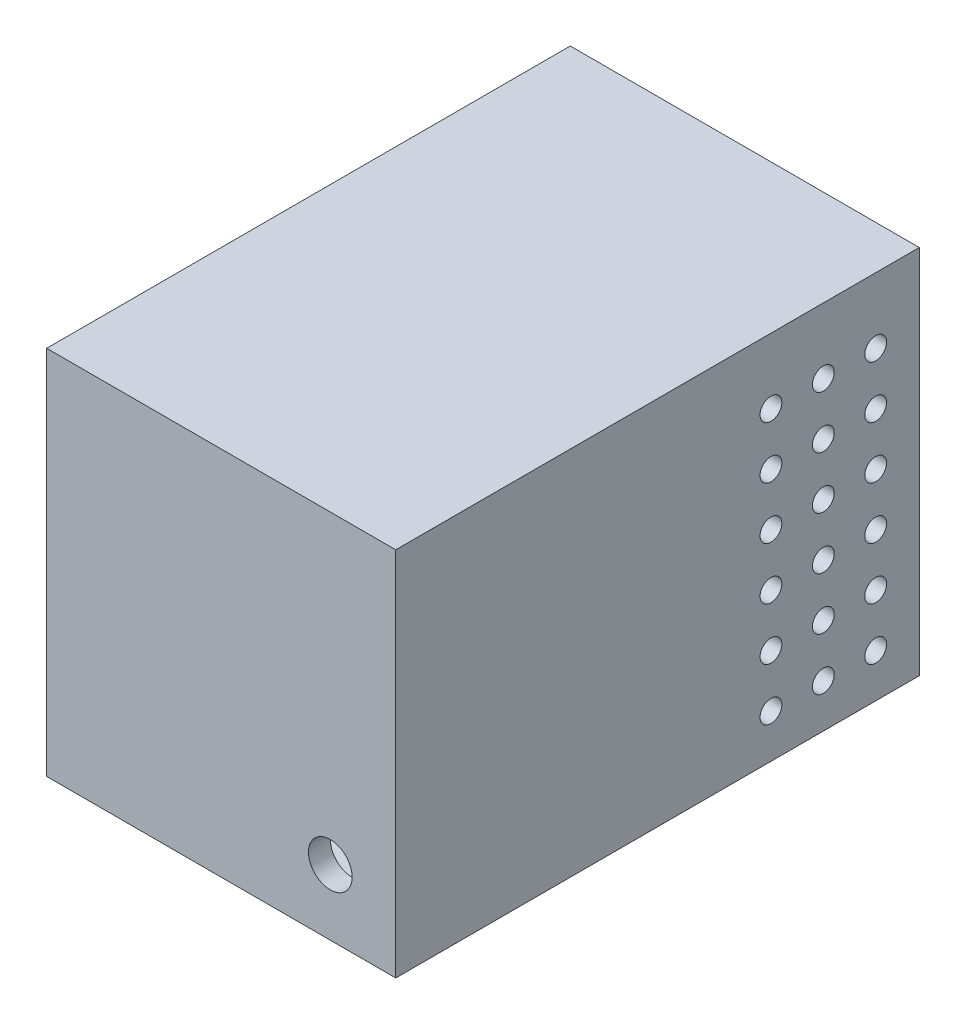
from build123d import *

# Parameters (mm, degrees)
SKETCH1_W               = 101.6
SKETCH1_H               = 152.4
BOSS_EXTRUDE1_DEPTH     = 101.6
SKETCH3_W               = 88.9
SKETCH3_H               = 139.7
CUT_EXTRUDE1_DEPTH      = 95.25
SKETCH4_W               = 88.9
SKETCH4_H               = 6.35
BOSS_EXTRUDE2_DEPTH     = 95.25
SKETCH6_R               = 3.175
CUT_EXTRUDE2_DEPTH      = 207.448256229
SKETCH7_R               = 3.175
CUT_EXTRUDE3_DEPTH      = 207.448256229
CUT_EXTRUDE5_DEPTH      = 210.453765781
CUT_EXTRUDE5_DEPTH_BACK = 6.35
SKETCH8_R               = 3.175
SKETCH9_W               = 101.6
SKETCH9_H               = 152.4
BOSS_EXTRUDE3_DEPTH     = 6.35
SKETCH10_R              = 6.35
CUT_EXTRUDE6_DEPTH      = 6.35


with BuildPart() as part:
    # Sketch1 → Boss-Extrude1 (new body)
    with BuildSketch(Plane(origin=(0, 0, 0), x_dir=(1, 0, 0), z_dir=(0, 1, 0))):
        with Locations((50.8, 76.2)):
            Rectangle(SKETCH1_W, SKETCH1_H)
    extrude(amount=BOSS_EXTRUDE1_DEPTH)

    # Sketch3 → Cut-Extrude1 (cut)
    with BuildSketch(Plane(origin=(0, 101.6, 0), x_dir=(1, 0, 0), z_dir=(0, 1, 0))):
        with Locations((50.8, 76.2)):
            Rectangle(SKETCH3_W, SKETCH3_H)
    extrude(amount=-CUT_EXTRUDE1_DEPTH, mode=Mode.SUBTRACT)

    # Sketch4 → Boss-Extrude2 (add)
    with BuildSketch(Plane(origin=(0, 6.35, 0), x_dir=(1, 0, 0), z_dir=(0, 1, 0))):
        with Locations((50.8, 98.425)):
            Rectangle(SKETCH4_W, SKETCH4_H)
    extrude(amount=BOSS_EXTRUDE2_DEPTH)

    # Sketch6 → Cut-Extrude2 (cut, through all)
    with BuildSketch(Plane.ZY.offset(-95.25)):
        with Locations((-139.7, 12.7)):
            Circle(SKETCH6_R)
        with Locations((-124.46, 12.7)):
            Circle(SKETCH6_R)
        with Locations((-109.22, 12.7)):
            Circle(SKETCH6_R)
        with Locations((-124.46, 27.94)):
            Circle(SKETCH6_R)
        with Locations((-109.22, 27.94)):
            Circle(SKETCH6_R)
        with Locations((-124.46, 43.18)):
            Circle(SKETCH6_R)
        with Locations((-109.22, 43.18)):
            Circle(SKETCH6_R)
        with Locations((-124.46, 58.42)):
            Circle(SKETCH6_R)
        with Locations((-109.22, 58.42)):
            Circle(SKETCH6_R)
        with Locations((-124.46, 73.66)):
            Circle(SKETCH6_R)
        with Locations((-109.22, 73.66)):
            Circle(SKETCH6_R)
        with Locations((-124.46, 88.9)):
            Circle(SKETCH6_R)
        with Locations((-109.22, 88.9)):
            Circle(SKETCH6_R)
        with Locations((-139.7, 27.94)):
            Circle(SKETCH6_R)
        with Locations((-139.7, 43.18)):
            Circle(SKETCH6_R)
        with Locations((-139.7, 58.42)):
            Circle(SKETCH6_R)
        with Locations((-139.7, 73.66)):
            Circle(SKETCH6_R)
        with Locations((-139.7, 88.9)):
            Circle(SKETCH6_R)
    extrude(amount=-CUT_EXTRUDE2_DEPTH, mode=Mode.SUBTRACT)

    # Sketch7 → Cut-Extrude3 (cut, through all)
    with BuildSketch(Plane(origin=(6.35, 0, 0), x_dir=(0, 0, -1), z_dir=(1, 0, 0))):
        with Locations(Location((139.7, 12.7, 0), (0, 0, 180))):
            Circle(SKETCH7_R)
        with Locations(Location((124.46, 12.7, 0), (0, 0, 180))):
            Circle(SKETCH7_R)
        with Locations(Location((109.22, 12.7, 0), (0, 0, 180))):
            Circle(SKETCH7_R)
        with Locations(Location((124.46, 27.94, 0), (0, 0, 180))):
            Circle(SKETCH7_R)
        with Locations(Location((109.22, 27.94, 0), (0, 0, 180))):
            Circle(SKETCH7_R)
        with Locations(Location((124.46, 43.18, 0), (0, 0, 180))):
            Circle(SKETCH7_R)
        with Locations(Location((109.22, 43.18, 0), (0, 0, 180))):
            Circle(SKETCH7_R)
        with Locations(Location((124.46, 58.42, 0), (0, 0, 180))):
            Circle(SKETCH7_R)
        with Locations(Location((109.22, 58.42, 0), (0, 0, 180))):
            Circle(SKETCH7_R)
        with Locations(Location((124.46, 73.66, 0), (0, 0, 180))):
            Circle(SKETCH7_R)
        with Locations(Location((109.22, 73.66, 0), (0, 0, 180))):
            Circle(SKETCH7_R)
        with Locations(Location((124.46, 88.9, 0), (0, 0, 180))):
            Circle(SKETCH7_R)
        with Locations(Location((109.22, 88.9, 0), (0, 0, 180))):
            Circle(SKETCH7_R)
        with Locations(Location((139.7, 27.94, 0), (0, 0, 180))):
            Circle(SKETCH7_R)
        with Locations(Location((139.7, 43.18, 0), (0, 0, 180))):
            Circle(SKETCH7_R)
        with Locations(Location((139.7, 58.42, 0), (0, 0, 180))):
            Circle(SKETCH7_R)
        with Locations(Location((139.7, 73.66, 0), (0, 0, 180))):
            Circle(SKETCH7_R)
        with Locations(Location((139.7, 88.9, 0), (0, 0, 180))):
            Circle(SKETCH7_R)
    extrude(amount=-CUT_EXTRUDE3_DEPTH, mode=Mode.SUBTRACT)

    # Sketch8 → Cut-Extrude5 (cut, two sides: drawn at the far end of the back side and taken through both)
    with BuildSketch(Plane(origin=(0, 0, -152.4), x_dir=(-1, 0, 0), z_dir=(0, 0, -1)).offset(-CUT_EXTRUDE5_DEPTH_BACK)):
        with Locations(Location((-88.9, 12.7, 0), (0, 0, 180))):
            Circle(SKETCH8_R)
        with Locations(Location((-73.66, 12.7, 0), (0, 0, 180))):
            Circle(SKETCH8_R)
        with Locations(Location((-58.42, 12.7, 0), (0, 0, 180))):
            Circle(SKETCH8_R)
        with Locations(Location((-43.18, 12.7, 0), (0, 0, 180))):
            Circle(SKETCH8_R)
        with Locations(Location((-27.94, 12.7, 0), (0, 0, 180))):
            Circle(SKETCH8_R)
        with Locations(Location((-12.7, 12.7, 0), (0, 0, 180))):
            Circle(SKETCH8_R)
        with Locations(Location((-73.66, 27.94, 0), (0, 0, 180))):
            Circle(SKETCH8_R)
        with Locations(Location((-58.42, 27.94, 0), (0, 0, 180))):
            Circle(SKETCH8_R)
        with Locations(Location((-43.18, 27.94, 0), (0, 0, 180))):
            Circle(SKETCH8_R)
        with Locations(Location((-27.94, 27.94, 0), (0, 0, 180))):
            Circle(SKETCH8_R)
        with Locations(Location((-12.7, 27.94, 0), (0, 0, 180))):
            Circle(SKETCH8_R)
        with Locations(Location((-73.66, 43.18, 0), (0, 0, 180))):
            Circle(SKETCH8_R)
        with Locations(Location((-58.42, 43.18, 0), (0, 0, 180))):
            Circle(SKETCH8_R)
        with Locations(Location((-43.18, 43.18, 0), (0, 0, 180))):
            Circle(SKETCH8_R)
        with Locations(Location((-27.94, 43.18, 0), (0, 0, 180))):
            Circle(SKETCH8_R)
        with Locations(Location((-12.7, 43.18, 0), (0, 0, 180))):
            Circle(SKETCH8_R)
        with Locations(Location((-73.66, 58.42, 0), (0, 0, 180))):
            Circle(SKETCH8_R)
        with Locations(Location((-58.42, 58.42, 0), (0, 0, 180))):
            Circle(SKETCH8_R)
        with Locations(Location((-43.18, 58.42, 0), (0, 0, 180))):
            Circle(SKETCH8_R)
        with Locations(Location((-27.94, 58.42, 0), (0, 0, 180))):
            Circle(SKETCH8_R)
        with Locations(Location((-12.7, 58.42, 0), (0, 0, 180))):
            Circle(SKETCH8_R)
        with Locations(Location((-73.66, 73.66, 0), (0, 0, 180))):
            Circle(SKETCH8_R)
        with Locations(Location((-58.42, 73.66, 0), (0, 0, 180))):
            Circle(SKETCH8_R)
        with Locations(Location((-43.18, 73.66, 0), (0, 0, 180))):
            Circle(SKETCH8_R)
        with Locations(Location((-27.94, 73.66, 0), (0, 0, 180))):
            Circle(SKETCH8_R)
        with Locations(Location((-12.7, 73.66, 0), (0, 0, 180))):
            Circle(SKETCH8_R)
        with Locations(Location((-73.66, 88.9, 0), (0, 0, 180))):
            Circle(SKETCH8_R)
        with Locations(Location((-58.42, 88.9, 0), (0, 0, 180))):
            Circle(SKETCH8_R)
        with Locations(Location((-43.18, 88.9, 0), (0, 0, 180))):
            Circle(SKETCH8_R)
        with Locations(Location((-27.94, 88.9, 0), (0, 0, 180))):
            Circle(SKETCH8_R)
        with Locations(Location((-12.7, 88.9, 0), (0, 0, 180))):
            Circle(SKETCH8_R)
        with Locations(Location((-88.9, 27.94, 0), (0, 0, 180))):
            Circle(SKETCH8_R)
        with Locations(Location((-88.9, 43.18, 0), (0, 0, 180))):
            Circle(SKETCH8_R)
        with Locations(Location((-88.9, 58.42, 0), (0, 0, 180))):
            Circle(SKETCH8_R)
        with Locations(Location((-88.9, 73.66, 0), (0, 0, 180))):
            Circle(SKETCH8_R)
        with Locations(Location((-88.9, 88.9, 0), (0, 0, 180))):
            Circle(SKETCH8_R)
    extrude(amount=CUT_EXTRUDE5_DEPTH + CUT_EXTRUDE5_DEPTH_BACK, mode=Mode.SUBTRACT)

    # Sketch9 → Boss-Extrude3 (add)
    with BuildSketch(Plane(origin=(0, 101.6, 0), x_dir=(1, 0, 0), z_dir=(0, 1, 0))):
        with Locations((50.8, 76.2)):
            Rectangle(SKETCH9_W, SKETCH9_H)
    extrude(amount=BOSS_EXTRUDE3_DEPTH)

    # Sketch10 → Cut-Extrude6 (cut)
    with BuildSketch(Plane(origin=(0, 0, -6.35), x_dir=(-1, 0, 0), z_dir=(0, 0, -1))):
        with Locations((-82.55, 19.05)):
            Circle(SKETCH10_R)
    extrude(amount=-CUT_EXTRUDE6_DEPTH, mode=Mode.SUBTRACT)


solid = part.part
